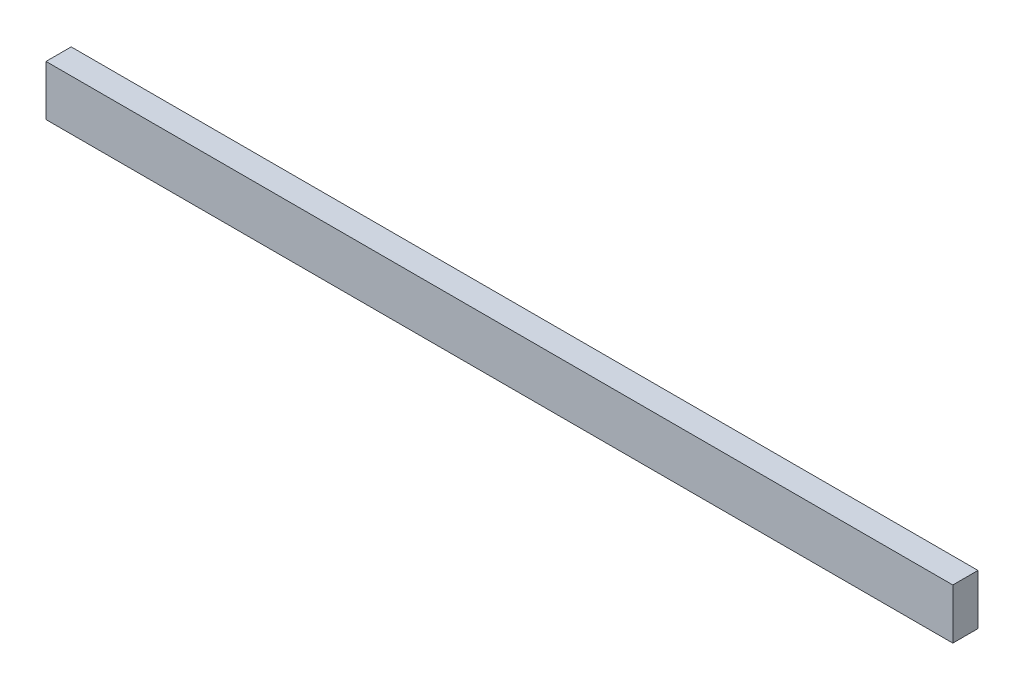
from build123d import *

# Parameters (mm, degrees)
SKETCH1_W           = 30
SKETCH1_H           = 60
BOSS_EXTRUDE1_DEPTH = 1080


with BuildPart() as part:
    # Sketch1 → Boss-Extrude1 (new body)
    with BuildSketch(Plane(origin=(0, 0, 0), x_dir=(0, 0, -1), z_dir=(1, 0, 0))):
        Rectangle(SKETCH1_W, SKETCH1_H)
    extrude(amount=BOSS_EXTRUDE1_DEPTH)


solid = part.part
